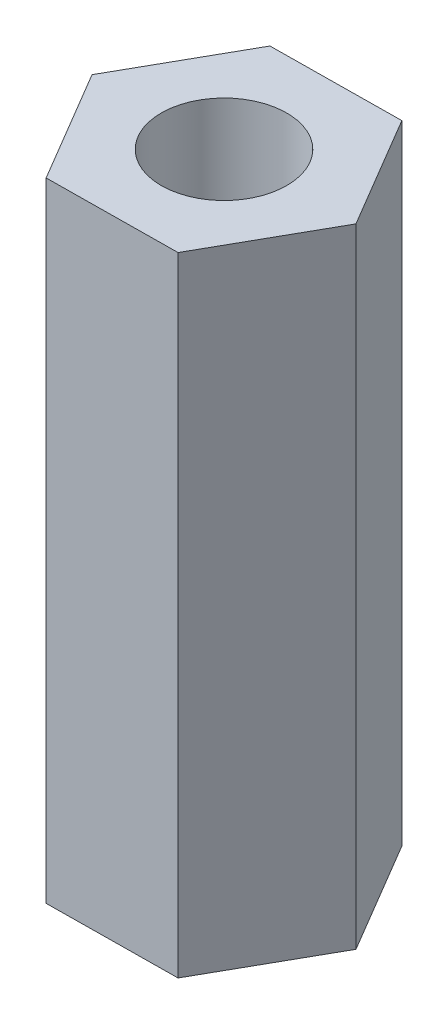
from build123d import *

# Parameters (mm, degrees)
SKETCH1_R           = 1.5
BOSS_EXTRUDE1_DEPTH = 15


with BuildPart() as part:
    # Sketch1 → Boss-Extrude1 (new body)
    with BuildSketch(Plane(origin=(0, 0, 0), x_dir=(1, 0, 0), z_dir=(0, 1, 0))):
        Polygon((1.53067561, 2.716069251), (-1.586847165, 2.683638589), (-3.117522775, -0.032430663), (-1.53067561, -2.716069251), (1.586847165, -2.683638589), (3.117522775, 0.032430663), align=None)
        with Locations(Location((0, 0, 0), (0, 0, 270))):
            Circle(SKETCH1_R, mode=Mode.SUBTRACT)
    extrude(amount=BOSS_EXTRUDE1_DEPTH)


solid = part.part
